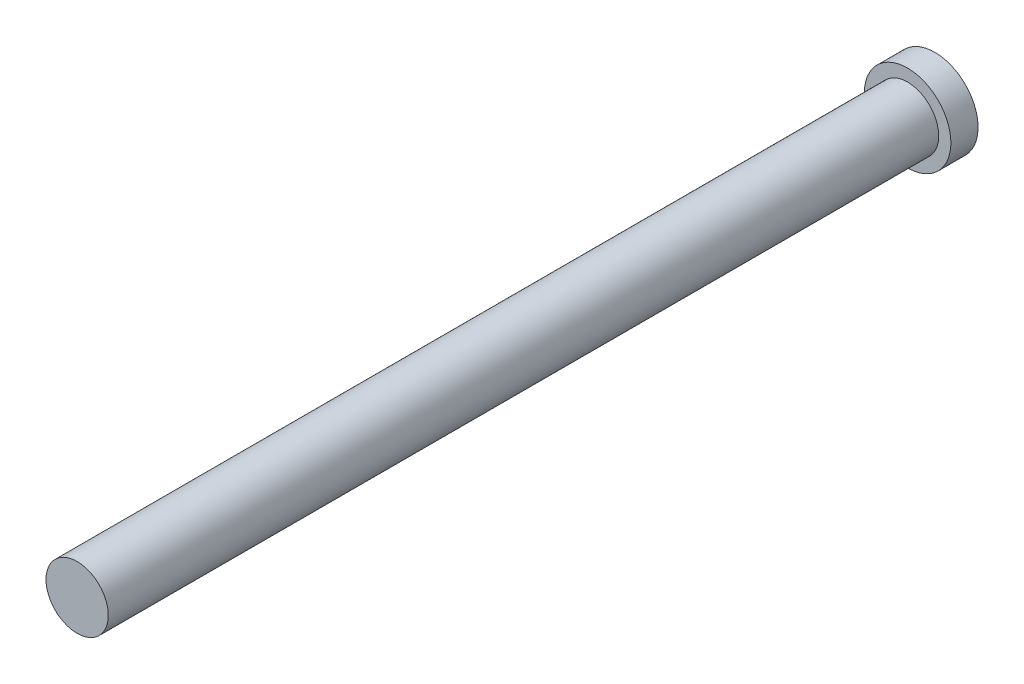
from build123d import *

# Parameters (mm, degrees)
SKETCH1_R           = 1.143
BOSS_EXTRUDE1_DEPTH = 30.48
SKETCH2_R           = 1.5875
BOSS_EXTRUDE2_DEPTH = 1


with BuildPart() as part:
    # Sketch1 → Boss-Extrude1 (new body)
    with BuildSketch(Plane.XY):
        with Locations(Location((0, 0, 0), (0, 0, 180))):
            Circle(SKETCH1_R)
    extrude(amount=BOSS_EXTRUDE1_DEPTH)

    # Sketch2 → Boss-Extrude2 (add)
    with BuildSketch(Plane(origin=(0, 0, 0), x_dir=(-1, 0, 0), z_dir=(0, 0, -1))):
        Circle(SKETCH2_R)
    extrude(amount=BOSS_EXTRUDE2_DEPTH)


solid = part.part
